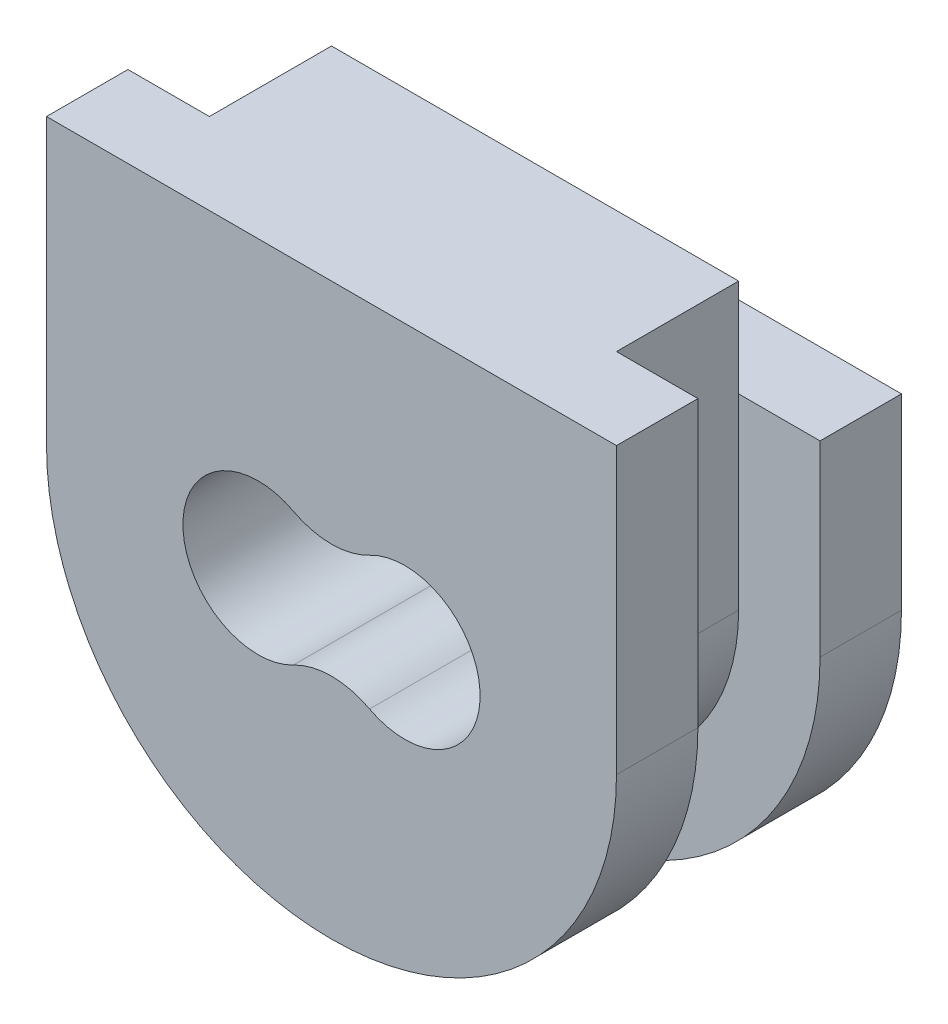
from build123d import *

# Parameters (mm, degrees)
BOSS_EXTRU_1_DEPTH           = 3
BOSS_EXTRU_2_DEPTH           = 2
BOSS_EXTRU_3_START           = 2
BOSS_EXTRU_3_DEPTH           = 2
ENL_V_MAT_EXTRU_1_DEPTH      = 12.090536506
ENL_V_MAT_EXTRU_1_DEPTH_BACK = 12.090536506
ESQUISSE5_W                  = 14
ESQUISSE5_H                  = 2.4
ENL_V_MAT_EXTRU_2_DEPTH      = 2


with BuildPart() as part:
    # Esquisse1 → Boss.-Extru.1 (new body)
    with BuildSketch(Plane.XY):
        with BuildLine():
            Line((-5, 0), (-5, 7))
            Line((-5, 7), (5, 7))
            Line((5, 7), (5, 0))
            ThreePointArc((5, 0), (0, -5), (-5, 0))
        make_face()
    extrude(amount=BOSS_EXTRU_1_DEPTH)

    # Esquisse2 → Boss.-Extru.2 (add)
    with BuildSketch(Plane.XY):
        with BuildLine():
            Line((-7, 7), (7, 7))
            Line((7, 7), (7, 0))
            ThreePointArc((7, 0), (0, -7), (-7, 0))
            Line((-7, 0), (-7, 7))
        make_face()
    extrude(amount=-BOSS_EXTRU_2_DEPTH)

    # Esquisse3 → Boss.-Extru.3 (add)
    with BuildSketch(Plane.XY.offset(3).offset(BOSS_EXTRU_3_START)):
        with BuildLine():
            Line((7, 7), (-7, 7))
            Line((-7, 7), (-7, 0))
            ThreePointArc((-7, 0), (0, -7), (7, 0))
            Line((7, 0), (7, 7))
        make_face()
    extrude(amount=-BOSS_EXTRU_3_DEPTH)

    # Esquisse4 → Enlèv. mat.-Extru.1 (cut, two sides: drawn at the far end of the back side and taken through both)
    with BuildSketch(Plane.XY.offset(-ENL_V_MAT_EXTRU_1_DEPTH_BACK)):
        with BuildLine():
            ThreePointArc((0.935064935, -1.635355415), (3.65, 0), (0.935064935, 1.635355415))
            ThreePointArc((0.935064935, 1.635355415), (0, 1.403307215), (-0.935064935, 1.635355415))
            ThreePointArc((-0.935064935, 1.635355415), (-3.65, 0), (-0.935064935, -1.635355415))
            ThreePointArc((-0.935064935, -1.635355415), (0, -1.403307215), (0.935064935, -1.635355415))
        make_face()
    extrude(amount=ENL_V_MAT_EXTRU_1_DEPTH + ENL_V_MAT_EXTRU_1_DEPTH_BACK, mode=Mode.SUBTRACT)

    # Esquisse5 → Enlèv. mat.-Extru.2 (cut)
    with BuildSketch(Plane(origin=(0, 0, -2), x_dir=(-1, 0, 0), z_dir=(0, 0, -1))):
        with Locations((0, 5.8)):
            Rectangle(ESQUISSE5_W, ESQUISSE5_H)
    extrude(amount=-ENL_V_MAT_EXTRU_2_DEPTH, mode=Mode.SUBTRACT)


solid = part.part
